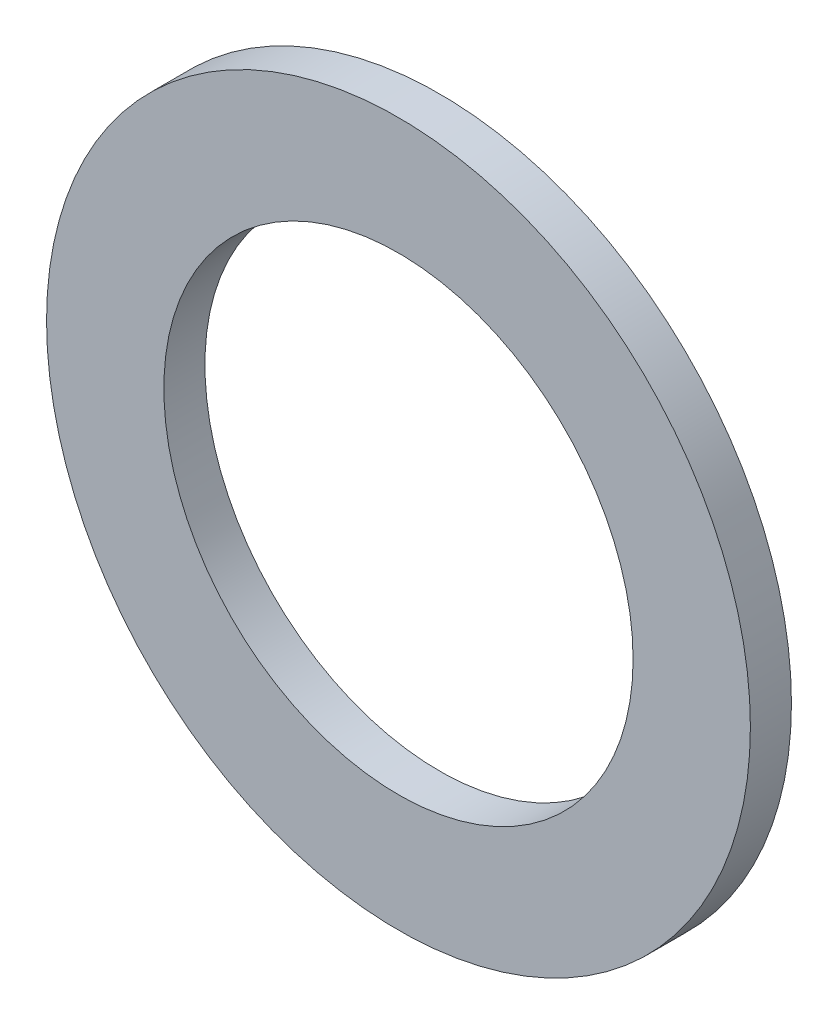
from build123d import *

# Parameters (mm, degrees)
SKETCH1_R           = 30
SKETCH1_R_2         = 20
BOSS_EXTRUDE1_DEPTH = 3.5


with BuildPart() as part:
    # Sketch1 → Boss-Extrude1 (new body)
    with BuildSketch(Plane.XY):
        Circle(SKETCH1_R)
        Circle(SKETCH1_R_2, mode=Mode.SUBTRACT)
    extrude(amount=BOSS_EXTRUDE1_DEPTH)


solid = part.part
